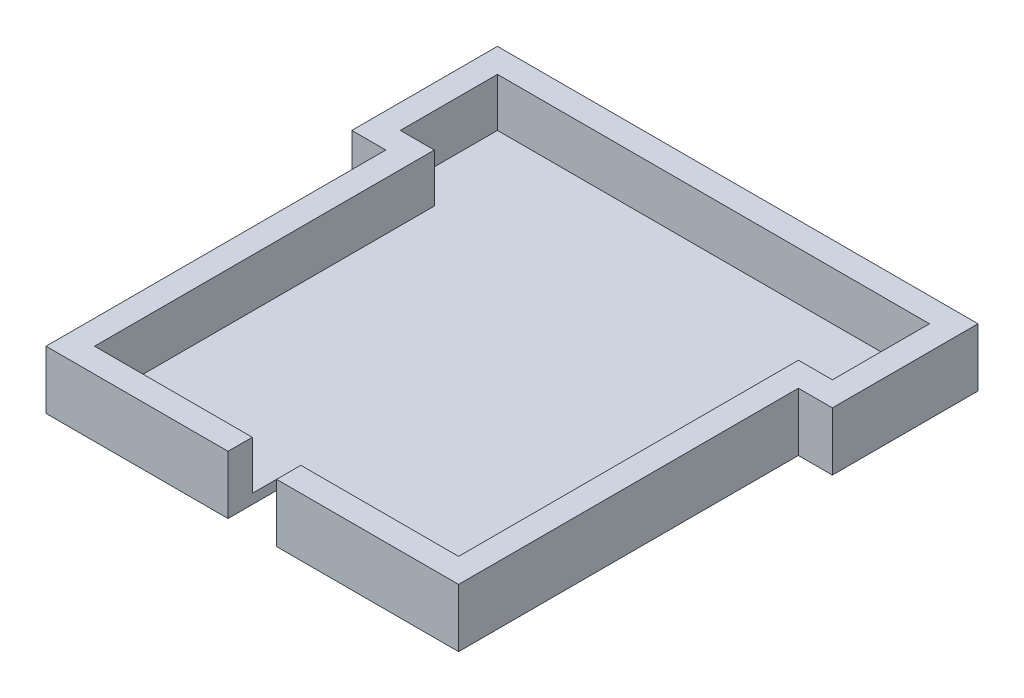
from build123d import *

# Parameters (mm, degrees)
BOSS_EXTRUDE2_DEPTH = 2
BOSS_EXTRUDE3_DEPTH = 12
SKETCH4_W           = 10
SKETCH4_H           = 12
CUT_EXTRUDE1_DEPTH  = 12


with BuildPart() as part:
    # Sketch1 → Boss-Extrude2 (new body)
    with BuildSketch(Plane(origin=(0, 0, 0), x_dir=(1, 0, 0), z_dir=(0, 1, 0))):
        Polygon((30.583615977, 95.111042946), (23.583615977, 95.111042946), (23.583615977, 115.111042946), (112.583615977, 115.111042946), (112.583615977, 95.111042946), (105.583615977, 95.111042946), (105.583615977, 25.111042946), (30.583615977, 25.111042946), align=None)
    extrude(amount=BOSS_EXTRUDE2_DEPTH)

    # Sketch3 → Boss-Extrude3 (add)
    with BuildSketch(Plane(origin=(0, 0, 0), x_dir=(1, 0, 0), z_dir=(0, 1, 0))):
        Polygon((25.583615977, 90.111042946), (25.583615977, 20.111042946), (110.583615977, 20.111042946), (110.583615977, 90.111042946), (117.583615977, 90.111042946), (117.583615977, 120.111042946), (18.583615977, 120.111042946), (18.583615977, 90.111042946), align=None)
        Polygon((30.583615977, 95.111042946), (23.583615977, 95.111042946), (23.583615977, 115.111042946), (112.583615977, 115.111042946), (112.583615977, 95.111042946), (105.583615977, 95.111042946), (105.583615977, 25.111042946), (30.583615977, 25.111042946), align=None, mode=Mode.SUBTRACT)
    extrude(amount=BOSS_EXTRUDE3_DEPTH)

    # Sketch4 → Cut-Extrude1 (cut)
    with BuildSketch(Plane.XY.offset(-20.111042946)):
        with Locations((68.083615977, 6)):
            Rectangle(SKETCH4_W, SKETCH4_H)
    extrude(amount=-CUT_EXTRUDE1_DEPTH, mode=Mode.SUBTRACT)


solid = part.part
